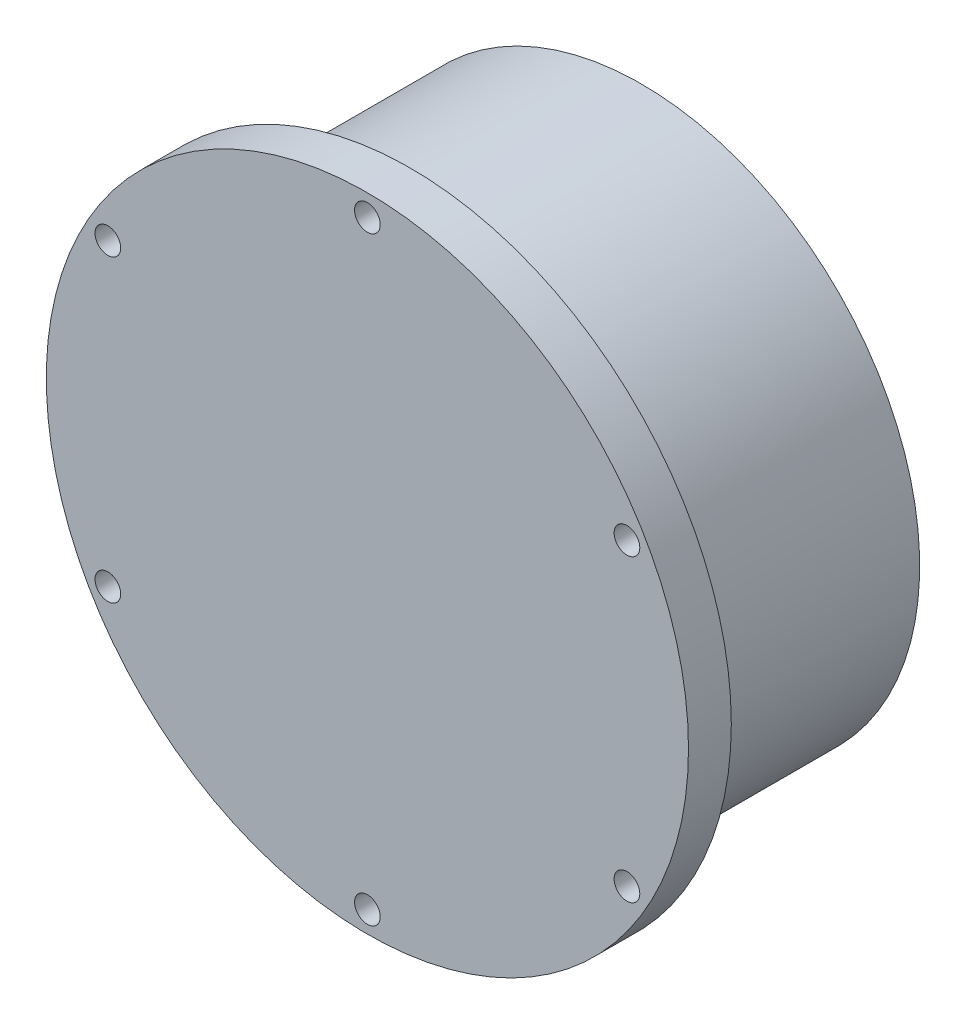
from build123d import *

# Parameters (mm, degrees)
SKETCH1_R           = 37.5
SKETCH1_R_2         = 1.5
BOSS_EXTRUDE1_DEPTH = 5
SKETCH2_R           = 32.5
BOSS_EXTRUDE2_DEPTH = 27
SKETCH3_R           = 12.5
BOSS_EXTRUDE3_DEPTH = 7.75


with BuildPart() as part:
    # Sketch1 → Boss-Extrude1 (new body)
    with BuildSketch(Plane.XY):
        Circle(SKETCH1_R)
        with Locations((0, 35)):
            Circle(SKETCH1_R_2, mode=Mode.SUBTRACT)
        with Locations((30.310889132, 17.5)):
            Circle(SKETCH1_R_2, mode=Mode.SUBTRACT)
        with Locations((30.310889132, -17.5)):
            Circle(SKETCH1_R_2, mode=Mode.SUBTRACT)
        with Locations((0, -35)):
            Circle(SKETCH1_R_2, mode=Mode.SUBTRACT)
        with Locations((-30.310889132, -17.5)):
            Circle(SKETCH1_R_2, mode=Mode.SUBTRACT)
        with Locations((-30.310889132, 17.5)):
            Circle(SKETCH1_R_2, mode=Mode.SUBTRACT)
    extrude(amount=BOSS_EXTRUDE1_DEPTH)

    # Sketch2 → Boss-Extrude2 (add)
    with BuildSketch(Plane(origin=(0, 0, 0), x_dir=(-1, 0, 0), z_dir=(0, 0, -1))):
        Circle(SKETCH2_R)
    extrude(amount=BOSS_EXTRUDE2_DEPTH)

    # Sketch3 → Boss-Extrude3 (add)
    with BuildSketch(Plane(origin=(0, 0, -27), x_dir=(-1, 0, 0), z_dir=(0, 0, -1))):
        Circle(SKETCH3_R)
    extrude(amount=BOSS_EXTRUDE3_DEPTH)


solid = part.part
